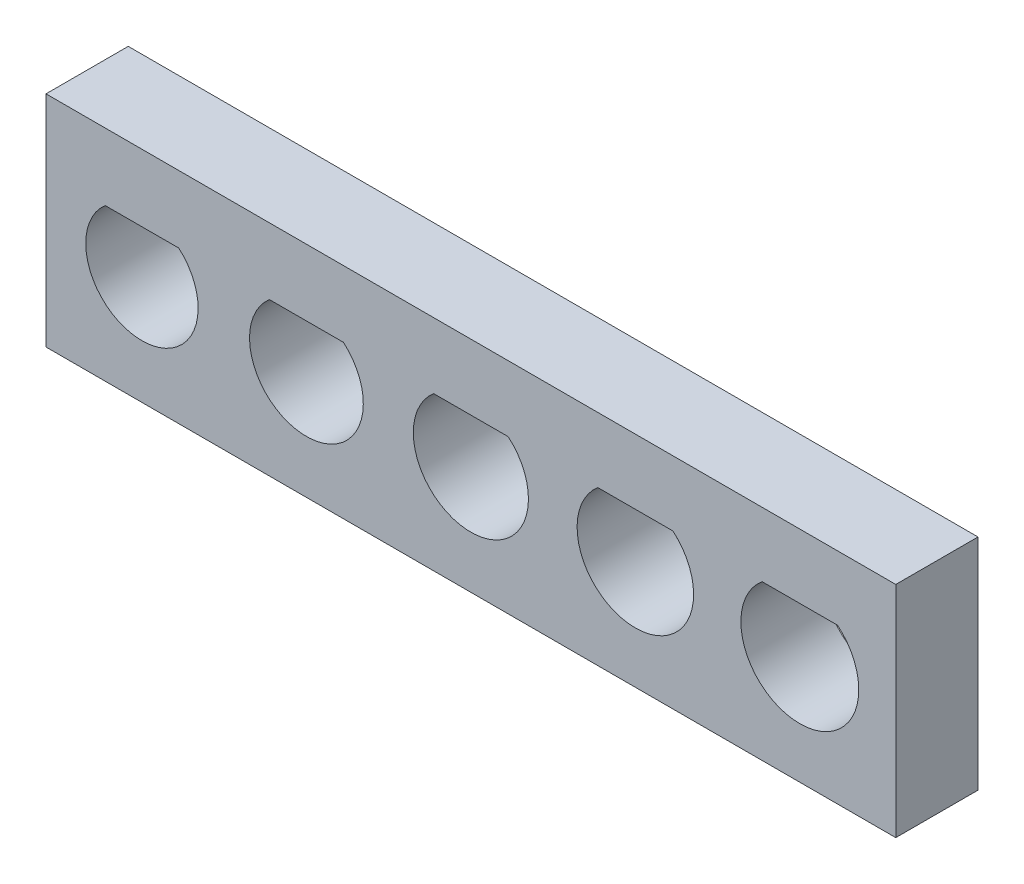
from build123d import *

# Parameters (mm, degrees)
SKETCH1_W           = 31
SKETCH1_H           = 8
BOSS_EXTRUDE1_DEPTH = 3


with BuildPart() as part:
    # Sketch1 → Boss-Extrude1 (new body)
    with BuildSketch(Plane.XY):
        with Locations((15.5, 4)):
            Rectangle(SKETCH1_W, SKETCH1_H)
        with BuildLine():
            Line((2.158359214, 5.55), (4.841640786, 5.55))
            ThreePointArc((4.841640786, 5.55), (3.5, 1.95), (2.158359214, 5.55))
        make_face(mode=Mode.SUBTRACT)
        with BuildLine():
            Line((8.149074391, 5.575), (10.850925609, 5.575))
            ThreePointArc((10.850925609, 5.575), (9.5, 1.925), (8.149074391, 5.575))
        make_face(mode=Mode.SUBTRACT)
        with BuildLine():
            Line((14.139852949, 5.6), (16.860147051, 5.6))
            ThreePointArc((16.860147051, 5.6), (15.5, 1.9), (14.139852949, 5.6))
        make_face(mode=Mode.SUBTRACT)
        with BuildLine():
            Line((20.130693606, 5.625), (22.869306394, 5.625))
            ThreePointArc((22.869306394, 5.625), (21.5, 1.875), (20.130693606, 5.625))
        make_face(mode=Mode.SUBTRACT)
        with BuildLine():
            Line((26.121595125, 5.65), (28.878404875, 5.65))
            ThreePointArc((28.878404875, 5.65), (27.5, 1.85), (26.121595125, 5.65))
        make_face(mode=Mode.SUBTRACT)
    extrude(amount=BOSS_EXTRUDE1_DEPTH)


solid = part.part
